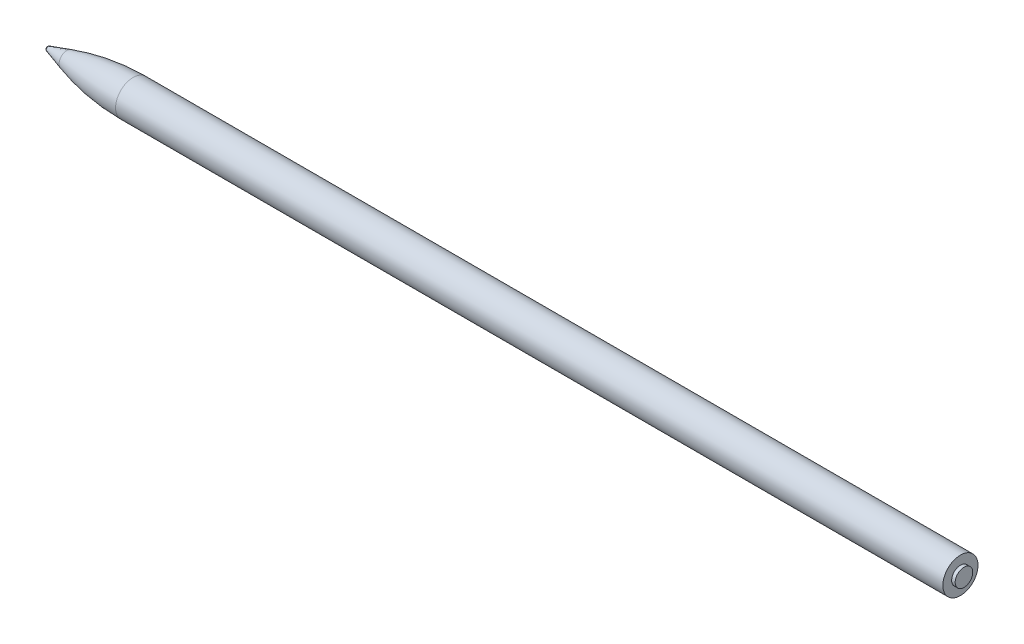
from build123d import *


with BuildPart() as part:
    # 草图1 → 旋转1 (revolve)
    with BuildSketch(Plane.XY):
        with BuildLine():
            Line((0, 0), (0, 0.5))
            Line((0, 0.5), (-0.2, 0.5))
            Line((-0.2, 0.5), (-0.2, 1))
            Line((-0.2, 1), (-47.293693689, 1))
            ThreePointArc((-47.293693689, 1), (-49.202536528, 0.859094798), (-51.07, 0.439433695))
            Line((-51.07, 0.439433695), (-52.107763063, 0.124394337))
            ThreePointArc((-52.107763063, 0.124394337), (-52.174425088, 0.077429974), (-52.2, 0))
            Line((-52.2, 0), (0, 0))
        make_face()
    revolve(axis=Axis((0, 0, 0), (-1, 0, 0)))


solid = part.part
